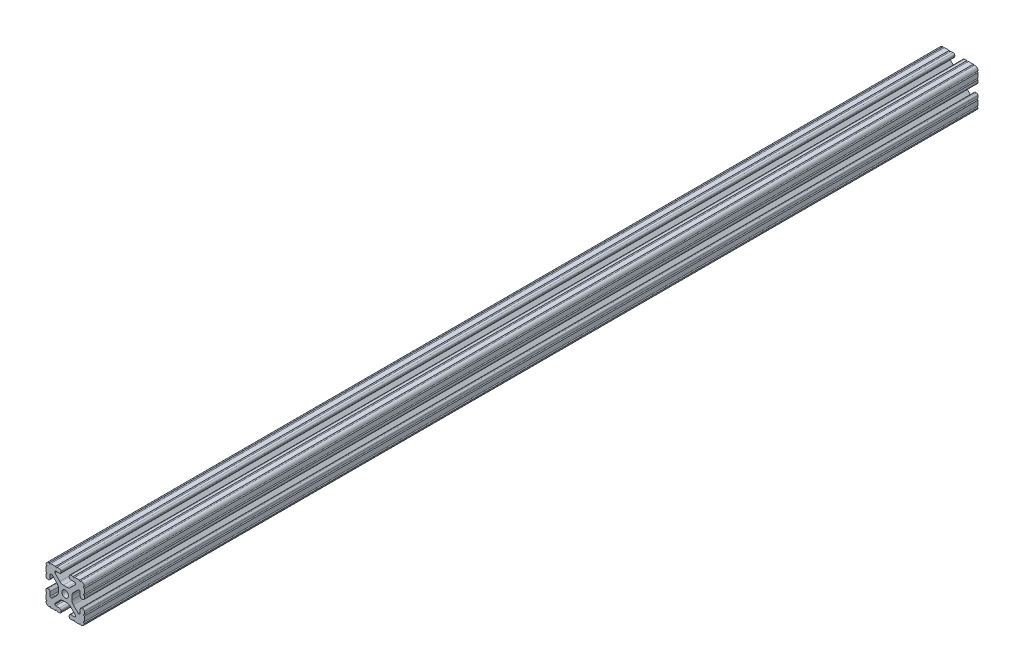
from build123d import *

# Parameters (mm, degrees)
SKETCH1_R           = 3.3274
BOSS_EXTRUDE1_DEPTH = 889


with BuildPart() as part:
    # Sketch1 → Boss-Extrude1 (new body)
    with BuildSketch(Plane.XY):
        with BuildLine():
            Line((-14.097, 10.287), (-13.528918, 10.287))
            ThreePointArc((-13.528918, 10.287), (-13.188712428, 10.219328904), (-12.900300071, 10.026617928))
            Line((-12.900300071, 10.026617928), (-8.129198975, 5.255516832))
            ThreePointArc((-8.129198975, 5.255516832), (-7.09957176, 3.71457081), (-6.738014764, 1.896901043))
            Line((-6.738014764, 1.896901043), (-6.738014764, -1.896901043))
            ThreePointArc((-6.738014764, -1.896901043), (-7.09957176, -3.71457081), (-8.129198975, -5.255516832))
            Line((-8.129198975, -5.255516832), (-12.900300071, -10.026617928))
            ThreePointArc((-12.900300071, -10.026617928), (-13.188712428, -10.219328904), (-13.528918, -10.287))
            Line((-13.528918, -10.287), (-14.097, -10.287))
            ThreePointArc((-14.097, -10.287), (-14.725617928, -10.026617928), (-14.986, -9.398))
            Line((-14.986, -9.398), (-14.986, -5.6388))
            ThreePointArc((-14.986, -5.6388), (-15.447248241, -4.525248241), (-16.5608, -4.064))
            Line((-16.5608, -4.064), (-17.4752, -4.064))
            ThreePointArc((-17.4752, -4.064), (-18.588751759, -4.525248241), (-19.05, -5.6388))
            Line((-19.05, -5.6388), (-19.05, -7.9756))
            ThreePointArc((-19.05, -7.9756), (-18.288, -8.7376), (-19.05, -9.4996))
            Line((-19.05, -9.4996), (-19.05, -14.3256))
            ThreePointArc((-19.05, -14.3256), (-18.288, -15.0876), (-19.05, -15.8496))
            Line((-19.05, -15.8496), (-19.05, -15.875))
            ThreePointArc((-19.05, -15.875), (-18.12006403, -18.12006403), (-15.875, -19.05))
            Line((-15.875, -19.05), (-15.8496, -19.05))
            ThreePointArc((-15.8496, -19.05), (-15.0876, -18.288), (-14.3256, -19.05))
            Line((-14.3256, -19.05), (-9.4996, -19.05))
            ThreePointArc((-9.4996, -19.05), (-8.7376, -18.288), (-7.9756, -19.05))
            Line((-7.9756, -19.05), (-5.6388, -19.05))
            ThreePointArc((-5.6388, -19.05), (-4.525248241, -18.588751759), (-4.064, -17.4752))
            Line((-4.064, -17.4752), (-4.064, -16.5608))
            ThreePointArc((-4.064, -16.5608), (-4.525248241, -15.447248241), (-5.6388, -14.986))
            Line((-5.6388, -14.986), (-9.398, -14.986))
            ThreePointArc((-9.398, -14.986), (-10.026617928, -14.725617928), (-10.287, -14.097))
            Line((-10.287, -14.097), (-10.287, -13.528918))
            ThreePointArc((-10.287, -13.528918), (-10.219328904, -13.188712428), (-10.026617928, -12.900300071))
            Line((-10.026617928, -12.900300071), (-5.255516832, -8.129198975))
            ThreePointArc((-5.255516832, -8.129198975), (-3.71457081, -7.09957176), (-1.896901043, -6.738014764))
            Line((-1.896901043, -6.738014764), (1.896901043, -6.738014764))
            ThreePointArc((1.896901043, -6.738014764), (3.71457081, -7.09957176), (5.255516832, -8.129198975))
            Line((5.255516832, -8.129198975), (10.026617928, -12.900300071))
            ThreePointArc((10.026617928, -12.900300071), (10.219328904, -13.188712428), (10.287, -13.528918))
            Line((10.287, -13.528918), (10.287, -14.097))
            ThreePointArc((10.287, -14.097), (10.026617928, -14.725617928), (9.398, -14.986))
            Line((9.398, -14.986), (5.6388, -14.986))
            ThreePointArc((5.6388, -14.986), (4.525248241, -15.447248241), (4.064, -16.5608))
            Line((4.064, -16.5608), (4.064, -17.4752))
            ThreePointArc((4.064, -17.4752), (4.525248241, -18.588751759), (5.6388, -19.05))
            Line((5.6388, -19.05), (7.9756, -19.05))
            ThreePointArc((7.9756, -19.05), (8.7376, -18.288), (9.4996, -19.05))
            Line((9.4996, -19.05), (14.3256, -19.05))
            ThreePointArc((14.3256, -19.05), (15.0876, -18.288), (15.8496, -19.05))
            Line((15.8496, -19.05), (15.875, -19.05))
            ThreePointArc((15.875, -19.05), (18.12006403, -18.12006403), (19.05, -15.875))
            Line((19.05, -15.875), (19.05, -15.8496))
            ThreePointArc((19.05, -15.8496), (18.288, -15.0876), (19.05, -14.3256))
            Line((19.05, -14.3256), (19.05, -9.4996))
            ThreePointArc((19.05, -9.4996), (18.288, -8.7376), (19.05, -7.9756))
            Line((19.05, -7.9756), (19.05, -5.6388))
            ThreePointArc((19.05, -5.6388), (18.588751759, -4.525248241), (17.4752, -4.064))
            Line((17.4752, -4.064), (16.5608, -4.064))
            ThreePointArc((16.5608, -4.064), (15.447248241, -4.525248241), (14.986, -5.6388))
            Line((14.986, -5.6388), (14.986, -9.398))
            ThreePointArc((14.986, -9.398), (14.725617928, -10.026617928), (14.097, -10.287))
            Line((14.097, -10.287), (13.528918, -10.287))
            ThreePointArc((13.528918, -10.287), (13.188712428, -10.219328904), (12.900300071, -10.026617928))
            Line((12.900300071, -10.026617928), (8.129198975, -5.255516832))
            ThreePointArc((8.129198975, -5.255516832), (7.09957176, -3.71457081), (6.738014764, -1.896901043))
            Line((6.738014764, -1.896901043), (6.738014764, 1.896901043))
            ThreePointArc((6.738014764, 1.896901043), (7.09957176, 3.71457081), (8.129198975, 5.255516832))
            Line((8.129198975, 5.255516832), (12.900300071, 10.026617928))
            ThreePointArc((12.900300071, 10.026617928), (13.188712428, 10.219328904), (13.528918, 10.287))
            Line((13.528918, 10.287), (14.097, 10.287))
            ThreePointArc((14.097, 10.287), (14.725617928, 10.026617928), (14.986, 9.398))
            Line((14.986, 9.398), (14.986, 5.6388))
            ThreePointArc((14.986, 5.6388), (15.447248241, 4.525248241), (16.5608, 4.064))
            Line((16.5608, 4.064), (17.4752, 4.064))
            ThreePointArc((17.4752, 4.064), (18.588751759, 4.525248241), (19.05, 5.6388))
            Line((19.05, 5.6388), (19.05, 7.9756))
            ThreePointArc((19.05, 7.9756), (18.288, 8.7376), (19.05, 9.4996))
            Line((19.05, 9.4996), (19.05, 14.3256))
            ThreePointArc((19.05, 14.3256), (18.288, 15.0876), (19.05, 15.8496))
            Line((19.05, 15.8496), (19.05, 15.875))
            ThreePointArc((19.05, 15.875), (18.12006403, 18.12006403), (15.875, 19.05))
            Line((15.875, 19.05), (15.8496, 19.05))
            ThreePointArc((15.8496, 19.05), (15.0876, 18.288), (14.3256, 19.05))
            Line((14.3256, 19.05), (9.4996, 19.05))
            ThreePointArc((9.4996, 19.05), (8.7376, 18.288), (7.9756, 19.05))
            Line((7.9756, 19.05), (5.6388, 19.05))
            ThreePointArc((5.6388, 19.05), (4.525248241, 18.588751759), (4.064, 17.4752))
            Line((4.064, 17.4752), (4.064, 16.5608))
            ThreePointArc((4.064, 16.5608), (4.525248241, 15.447248241), (5.6388, 14.986))
            Line((5.6388, 14.986), (9.398, 14.986))
            ThreePointArc((9.398, 14.986), (10.026617928, 14.725617928), (10.287, 14.097))
            Line((10.287, 14.097), (10.287, 13.528918))
            ThreePointArc((10.287, 13.528918), (10.219328904, 13.188712428), (10.026617928, 12.900300071))
            Line((10.026617928, 12.900300071), (5.255516832, 8.129198975))
            ThreePointArc((5.255516832, 8.129198975), (3.71457081, 7.09957176), (1.896901043, 6.738014764))
            Line((1.896901043, 6.738014764), (-1.896901043, 6.738014764))
            ThreePointArc((-1.896901043, 6.738014764), (-3.71457081, 7.09957176), (-5.255516832, 8.129198975))
            Line((-5.255516832, 8.129198975), (-10.026617928, 12.900300071))
            ThreePointArc((-10.026617928, 12.900300071), (-10.219328904, 13.188712428), (-10.287, 13.528918))
            Line((-10.287, 13.528918), (-10.287, 14.097))
            ThreePointArc((-10.287, 14.097), (-10.026617928, 14.725617928), (-9.398, 14.986))
            Line((-9.398, 14.986), (-5.6388, 14.986))
            ThreePointArc((-5.6388, 14.986), (-4.525248241, 15.447248241), (-4.064, 16.5608))
            Line((-4.064, 16.5608), (-4.064, 17.4752))
            ThreePointArc((-4.064, 17.4752), (-4.525248241, 18.588751759), (-5.6388, 19.05))
            Line((-5.6388, 19.05), (-7.9756, 19.05))
            ThreePointArc((-7.9756, 19.05), (-8.7376, 18.288), (-9.4996, 19.05))
            Line((-9.4996, 19.05), (-14.3256, 19.05))
            ThreePointArc((-14.3256, 19.05), (-15.0876, 18.288), (-15.8496, 19.05))
            Line((-15.8496, 19.05), (-15.875, 19.05))
            ThreePointArc((-15.875, 19.05), (-18.12006403, 18.12006403), (-19.05, 15.875))
            Line((-19.05, 15.875), (-19.05, 15.8496))
            ThreePointArc((-19.05, 15.8496), (-18.288, 15.0876), (-19.05, 14.3256))
            Line((-19.05, 14.3256), (-19.05, 9.4996))
            ThreePointArc((-19.05, 9.4996), (-18.288, 8.7376), (-19.05, 7.9756))
            Line((-19.05, 7.9756), (-19.05, 5.6388))
            ThreePointArc((-19.05, 5.6388), (-18.588751759, 4.525248241), (-17.4752, 4.064))
            Line((-17.4752, 4.064), (-16.5608, 4.064))
            ThreePointArc((-16.5608, 4.064), (-15.447248241, 4.525248241), (-14.986, 5.6388))
            Line((-14.986, 5.6388), (-14.986, 9.398))
            ThreePointArc((-14.986, 9.398), (-14.725617928, 10.026617928), (-14.097, 10.287))
        make_face()
        Circle(SKETCH1_R, mode=Mode.SUBTRACT)
    extrude(amount=BOSS_EXTRUDE1_DEPTH)


solid = part.part
